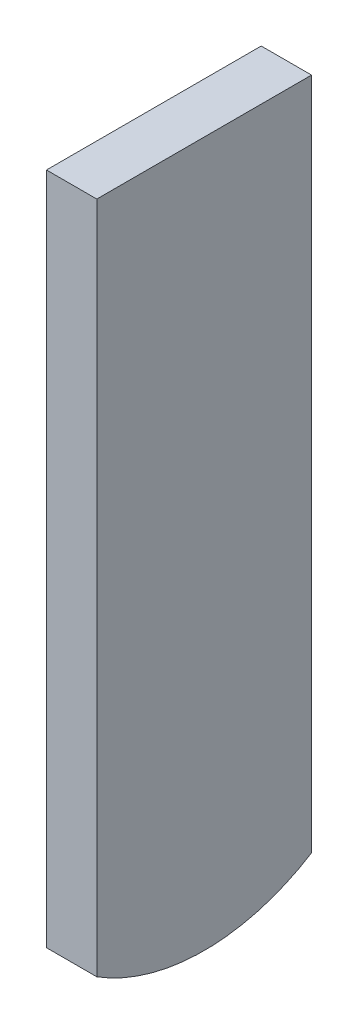
from build123d import *

# Parameters (mm, degrees)
SPIN_W           = 1.5
SPIN_H           = 6.4
FPIN_DEPTH       = 21
FPIN2_DEPTH      = 22.255646309
FPIN2_DEPTH_BACK = 22.255646309


with BuildPart() as part:
    # SPin → FPin (new body)
    with BuildSketch(Plane(origin=(0, 0, 0), x_dir=(1, 0, 0), z_dir=(0, 1, 0))):
        Rectangle(SPIN_W, SPIN_H)
    extrude(amount=-FPIN_DEPTH)

    # SPin2 → FPin2 (cut, two sides: drawn at the far end of the back side and taken through both)
    with BuildSketch(Plane(origin=(0, 0, 0), x_dir=(0, 0, -1), z_dir=(1, 0, 0)).offset(-FPIN2_DEPTH_BACK)):
        with BuildLine():
            Line((-47.307022322, 7.733531608), (-3.2, -20.075431016))
            ThreePointArc((-3.2, -20.075431016), (0, -21), (3.2, -20.075431016))
            Line((3.2, -20.075431016), (47.307022322, 7.733531608))
            Line((47.307022322, 7.733531608), (47.307022322, -96.550078233))
            Line((47.307022322, -96.550078233), (-47.307022322, -96.550078233))
            Line((-47.307022322, -96.550078233), (-47.307022322, 7.733531608))
        make_face()
    extrude(amount=FPIN2_DEPTH + FPIN2_DEPTH_BACK, mode=Mode.SUBTRACT)


solid = part.part
